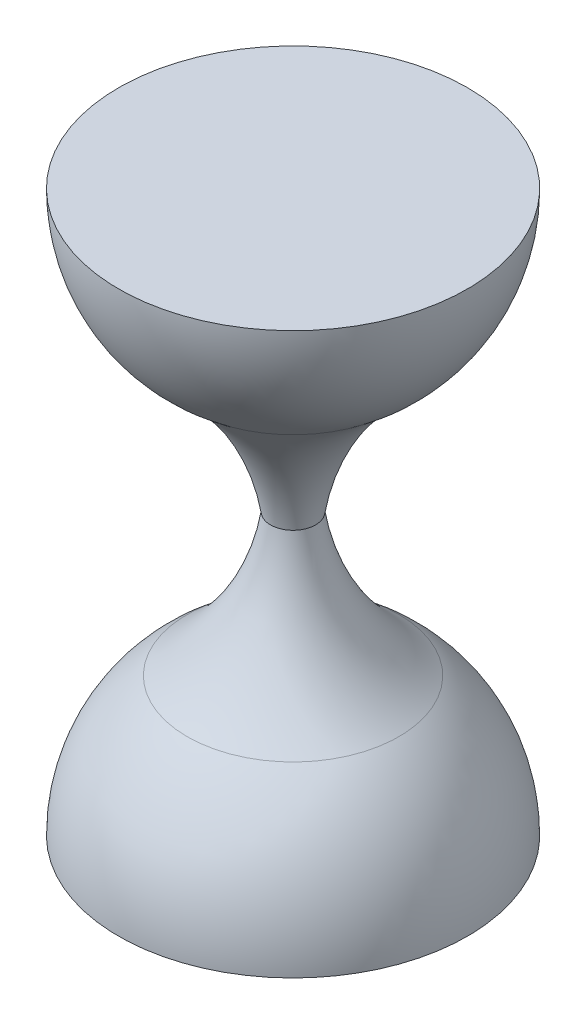
from build123d import *


with BuildPart() as part:
    # Sketch1 → Revolve1 (revolve)
    with BuildSketch(Plane.XY, mode=Mode.PRIVATE) as revolve1_sk:
        with BuildLine():
            Line((0, 0), (0, 57.15))
            Line((0, 57.15), (35.56, 57.15))
            ThreePointArc((35.56, 57.15), (31.875730438, 41.387658517), (21.586354948, 28.891498977))
            ThreePointArc((21.586354948, 28.891498977), (10.258807987, 16.109641662), (4.587067332, 0))
            Line((4.587067332, 0), (0, 0))
        make_face()
    revolve1 = revolve(revolve1_sk.sketch.rotate(Axis((0, 0, 0), (0, 1, 0)), 90), axis=Axis((0, 0, 0), (0, 1, 0)))

    # Mirror1: Revolve1 across plane
    add(revolve1.mirror(Plane(origin=(4.587067332, 0, 0), x_dir=(0, 0, 1), z_dir=(0, -1, 0))))


solid = part.part
